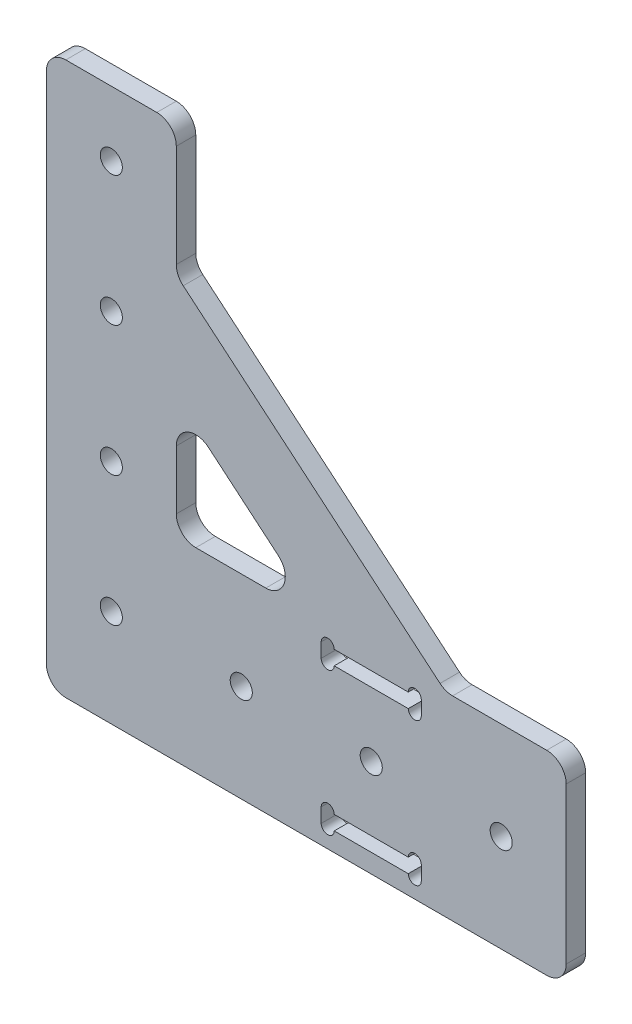
from build123d import *

# Parameters (mm, degrees)
EXTRUDE_1_DEPTH     = 3
SKETCH_2_R          = 1.7
CUT_EXTRUDE_1_DEPTH = 117.764720699
SKETCH_3_W          = 15.4
SKETCH_3_H          = 2.2
CUT_EXTRUDE_2_DEPTH = 10
CUT_EXTRUDE_3_DEPTH = 10
FILLET_1_R          = 3
FILLET_2_R          = 3


with BuildPart() as part:
    # 草图1 → 凸台-拉伸1 (new body)
    with BuildSketch(Plane.XY):
        Polygon((0, 85), (0, 0), (80, 0), (80, 30), (61.422003178, 30), (20, 64.832139036), (20, 85), align=None)
        Polygon((20, 30), (20, 48.5), (42, 30), align=None, mode=Mode.SUBTRACT)
    extrude(amount=EXTRUDE_1_DEPTH)

    # 草图2 → 切除-拉伸1 (cut, through all)
    with BuildSketch(Plane.XY.offset(3)):
        with Locations((10, 75)):
            Circle(SKETCH_2_R)
        with Locations((10, 55)):
            Circle(SKETCH_2_R)
        with Locations((10, 35)):
            Circle(SKETCH_2_R)
        with Locations((30, 15)):
            Circle(SKETCH_2_R)
        with Locations((50, 15)):
            Circle(SKETCH_2_R)
        with Locations((70, 15)):
            Circle(SKETCH_2_R)
        with Locations((10, 15)):
            Circle(SKETCH_2_R)
    extrude(amount=-CUT_EXTRUDE_1_DEPTH, mode=Mode.SUBTRACT)

    # 草图3 → 切除-拉伸2 (cut)
    with BuildSketch(Plane.XY.offset(3)):
        with Locations((50, 26)):
            Rectangle(SKETCH_3_W, SKETCH_3_H)
        with Locations((50, 4)):
            Rectangle(SKETCH_3_W, SKETCH_3_H)
    extrude(amount=-CUT_EXTRUDE_2_DEPTH, mode=Mode.SUBTRACT)

    # 草图4 → 切除-拉伸3 (cut)
    with BuildSketch(Plane.XY.offset(3)):
        with BuildLine():
            Line((44.3, 27.1), (55.7, 27.1))
            ThreePointArc((55.7, 27.1), (56.7, 28.1), (57.7, 27.1))
            Line((57.7, 27.1), (57.7, 24.9))
            ThreePointArc((57.7, 24.9), (56.7, 23.9), (55.7, 24.9))
            Line((55.7, 24.9), (44.3, 24.9))
            ThreePointArc((44.3, 24.9), (43.3, 23.9), (42.3, 24.9))
            Line((42.3, 24.9), (42.3, 27.1))
            ThreePointArc((42.3, 27.1), (43.3, 28.1), (44.3, 27.1))
        make_face()
        with BuildLine():
            Line((42.3, 5.1), (42.3, 2.9))
            ThreePointArc((42.3, 2.9), (43.3, 1.9), (44.3, 2.9))
            Line((44.3, 2.9), (55.7, 2.9))
            ThreePointArc((55.7, 2.9), (56.7, 1.9), (57.7, 2.9))
            Line((57.7, 2.9), (57.7, 5.1))
            ThreePointArc((57.7, 5.1), (56.7, 6.1), (55.7, 5.1))
            Line((55.7, 5.1), (44.3, 5.1))
            ThreePointArc((44.3, 5.1), (43.3, 6.1), (42.3, 5.1))
        make_face()
    extrude(amount=-CUT_EXTRUDE_3_DEPTH, mode=Mode.SUBTRACT)

    # 圆角1
    fillet_1_edges = [part.edges().sort_by_distance(p)[0] for p in [
        (20, 85, 1.5),
        (20, 64.832139036, 1.5),
        (61.422003178, 30, 1.5),
        (80, 30, 1.5),
        (80, 0, 1.5),
        (0, 0, 1.5),
        (0, 85, 1.5),
    ]]
    fillet(fillet_1_edges, radius=FILLET_1_R)

    # 圆角2
    fillet_2_edges = [part.edges().sort_by_distance(p)[0] for p in [
        (20, 30, 1.5),
        (42, 30, 1.5),
        (20, 48.5, 1.5),
    ]]
    fillet(fillet_2_edges, radius=FILLET_2_R)


solid = part.part
